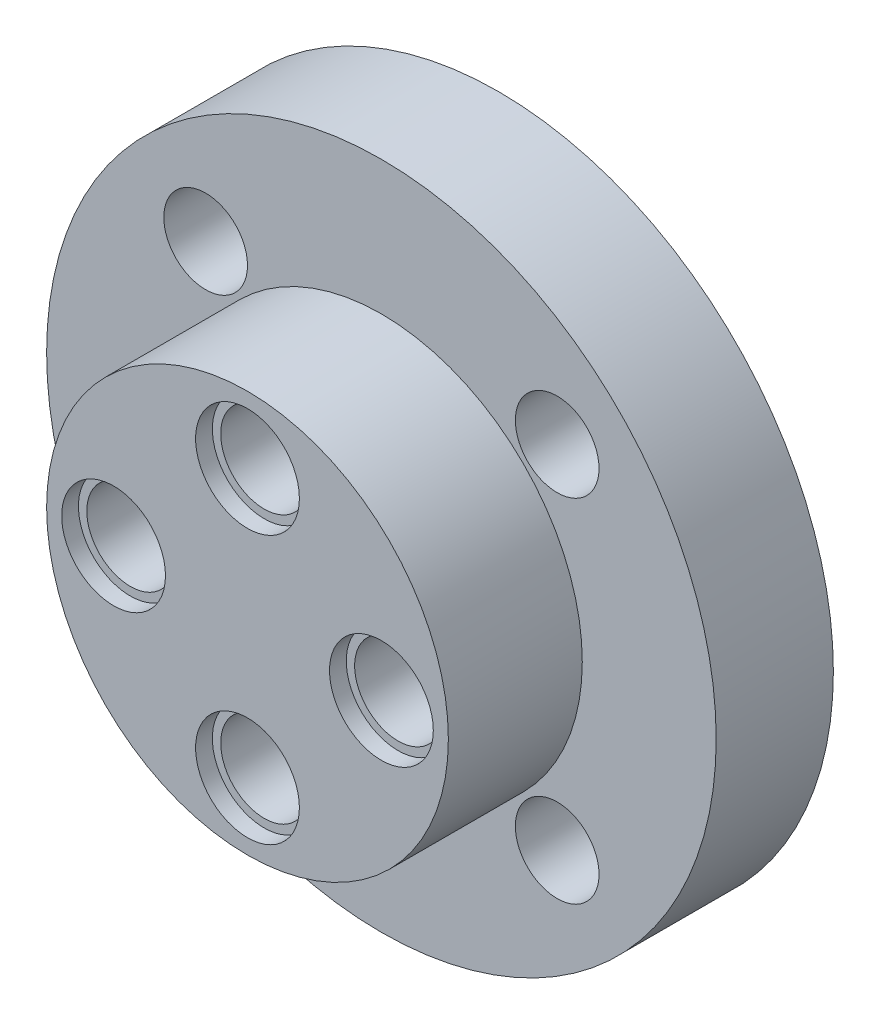
from build123d import *

# Parameters (mm, degrees)
SKETCH_1_R          = 20
SKETCH_1_R_2        = 2.5
EXTRUDE_1_DEPTH     = 7
SKETCH_2_R          = 12
EXTRUDE_2_DEPTH     = 8
SKETCH_3_R          = 2.6
CUT_EXTRUDE_1_DEPTH = 7
SKETCH_4_R          = 3.1
CUT_EXTRUDE_2_DEPTH = 1
SKETCH_6_R          = 3.1
CUT_EXTRUDE_3_DEPTH = 1


with BuildPart() as part:
    # Эскиз1 → Бобышка-Вытянуть1 (new body)
    with BuildSketch(Plane.XY):
        Circle(SKETCH_1_R)
        with Locations((-10.5, 10.5)):
            Circle(SKETCH_1_R_2, mode=Mode.SUBTRACT)
        with Locations((10.5, 10.5)):
            Circle(SKETCH_1_R_2, mode=Mode.SUBTRACT)
        with Locations((10.5, -10.5)):
            Circle(SKETCH_1_R_2, mode=Mode.SUBTRACT)
        with Locations((-10.5, -10.5)):
            Circle(SKETCH_1_R_2, mode=Mode.SUBTRACT)
    extrude(amount=EXTRUDE_1_DEPTH)

    # Эскиз2 → Бобышка-Вытянуть2 (add)
    with BuildSketch(Plane.XY.offset(7)):
        Circle(SKETCH_2_R)
    extrude(amount=EXTRUDE_2_DEPTH)

    # Эскиз3 → Вырез-Вытянуть1 (cut)
    with BuildSketch(Plane.XY.offset(15)):
        with Locations((-8, 0)):
            Circle(SKETCH_3_R)
        with Locations((0, 8)):
            Circle(SKETCH_3_R)
        with Locations((8, 0)):
            Circle(SKETCH_3_R)
        with Locations((0, -8)):
            Circle(SKETCH_3_R)
    extrude(amount=-CUT_EXTRUDE_1_DEPTH, mode=Mode.SUBTRACT)

    # Эскиз4 → Вырез-Вытянуть2 (cut)
    with BuildSketch(Plane.XY.offset(15)):
        with Locations((-8, 0)):
            Circle(SKETCH_4_R)
        with Locations((0, 8)):
            Circle(SKETCH_4_R)
        with Locations((8, 0)):
            Circle(SKETCH_4_R)
        with Locations((0, -8)):
            Circle(SKETCH_4_R)
    extrude(amount=-CUT_EXTRUDE_2_DEPTH, mode=Mode.SUBTRACT)

    # Эскиз6 → Вырез-Вытянуть3 (cut)
    with BuildSketch(Plane.XY.offset(8)):
        with Locations((8, 0)):
            Circle(SKETCH_6_R)
        with Locations((0, 8)):
            Circle(SKETCH_6_R)
        with Locations((-8, 0)):
            Circle(SKETCH_6_R)
        with Locations((0, -8)):
            Circle(SKETCH_6_R)
    extrude(amount=-CUT_EXTRUDE_3_DEPTH, mode=Mode.SUBTRACT)


solid = part.part
